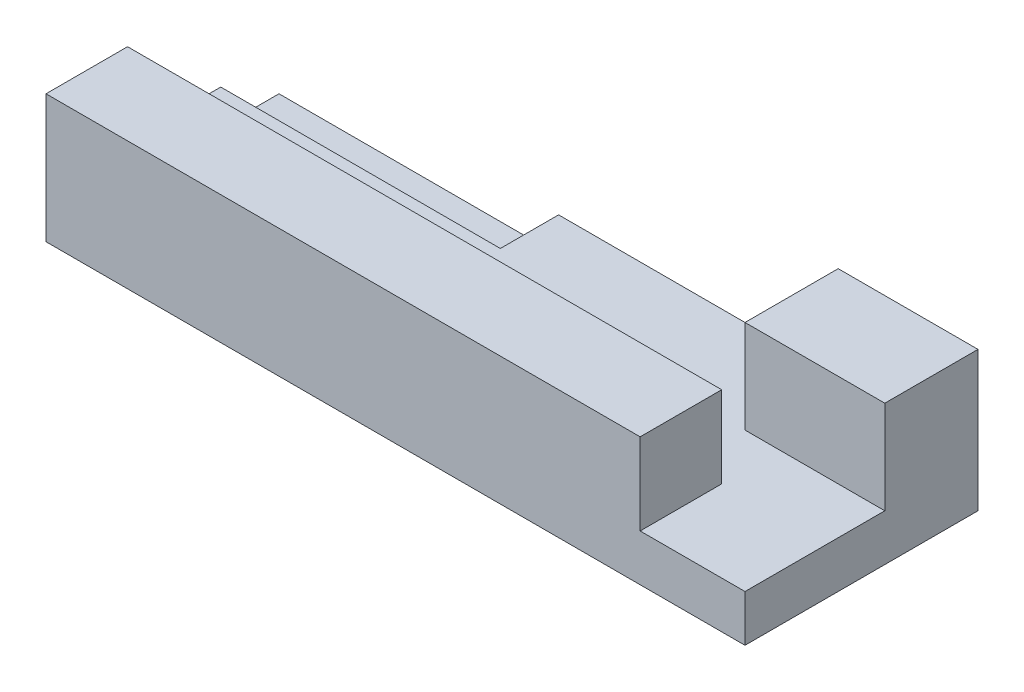
from build123d import *

# Parameters (mm, degrees)
SKETCH1_W           = 300
SKETCH1_H           = 100
BOSS_EXTRUDE1_DEPTH = 20
SKETCH1_3_W         = 255
SKETCH1_3_H         = 35
BOSS_EXTRUDE2_DEPTH = 55
SKETCH1_5_W         = 60
SKETCH1_5_H         = 40
BOSS_EXTRUDE3_DEPTH = 60
CUT_EXTRUDE1_START  = 20
SKETCH1_6_W         = 120
SKETCH1_6_H         = 25
CUT_EXTRUDE1_DEPTH  = 15


with BuildPart() as part:
    # Sketch1 → Boss-Extrude1 (new body)
    with BuildSketch(Plane(origin=(0, 0, 0), x_dir=(1, 0, 0), z_dir=(0, 1, 0))):
        Rectangle(SKETCH1_W, SKETCH1_H)
    extrude(amount=BOSS_EXTRUDE1_DEPTH)

    # Sketch1<3> → Boss-Extrude2 (add)
    with BuildSketch(Plane(origin=(0, 0, 0), x_dir=(1, 0, 0), z_dir=(0, 1, 0))):
        with Locations((-22.5, -32.5)):
            Rectangle(SKETCH1_3_W, SKETCH1_3_H)
    extrude(amount=BOSS_EXTRUDE2_DEPTH)

    # Sketch1<5> → Boss-Extrude3 (add)
    with BuildSketch(Plane(origin=(0, 0, 0), x_dir=(1, 0, 0), z_dir=(0, 1, 0))):
        with Locations((120, 30)):
            Rectangle(SKETCH1_5_W, SKETCH1_5_H)
    extrude(amount=BOSS_EXTRUDE3_DEPTH)

    # Sketch1<6> → Cut-Extrude1 (cut)
    with BuildSketch(Plane(origin=(0, 0, 0), x_dir=(1, 0, 0), z_dir=(0, 1, 0)).offset(CUT_EXTRUDE1_START)):
        with Locations((-90, 37.5)):
            Rectangle(SKETCH1_6_W, SKETCH1_6_H)
    extrude(amount=-CUT_EXTRUDE1_DEPTH, mode=Mode.SUBTRACT)


solid = part.part
